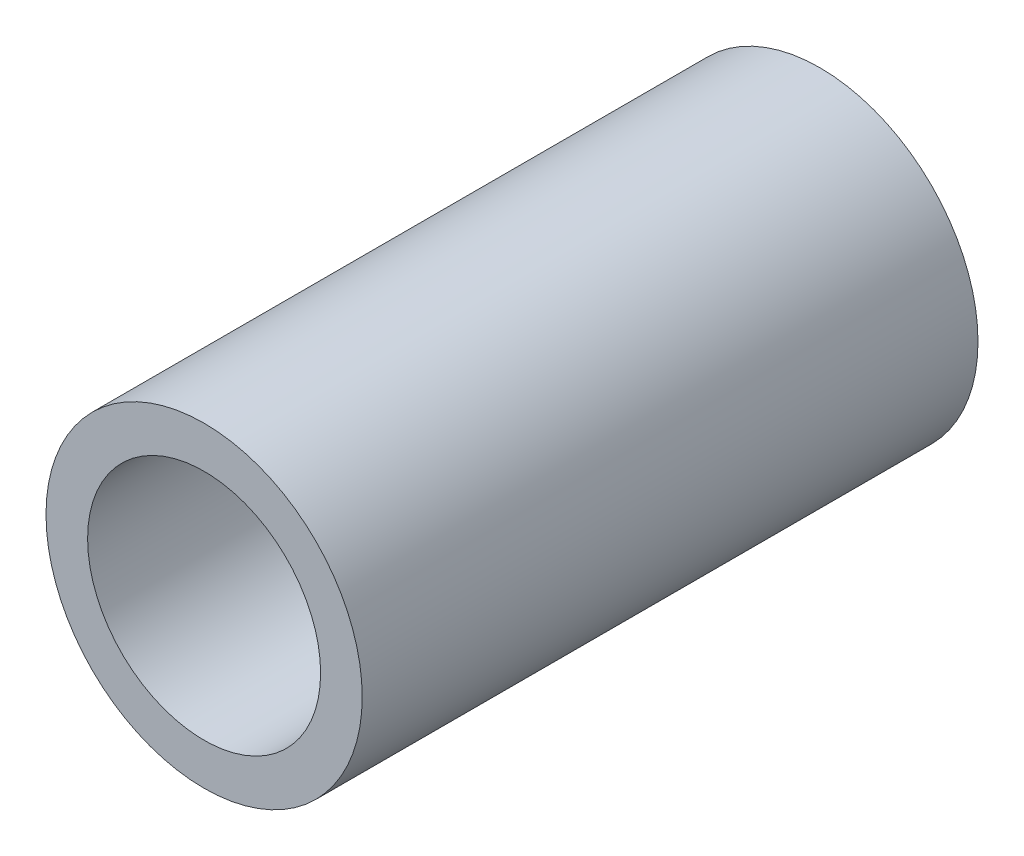
from build123d import *

# Parameters (mm, degrees)
SKETCH1_R           = 9.5
SKETCH1_R_2         = 7
BOSS_EXTRUDE1_DEPTH = 37


with BuildPart() as part:
    # Sketch1 → Boss-Extrude1 (new body)
    with BuildSketch(Plane.XY):
        Circle(SKETCH1_R)
        Circle(SKETCH1_R_2, mode=Mode.SUBTRACT)
    extrude(amount=BOSS_EXTRUDE1_DEPTH)


solid = part.part
